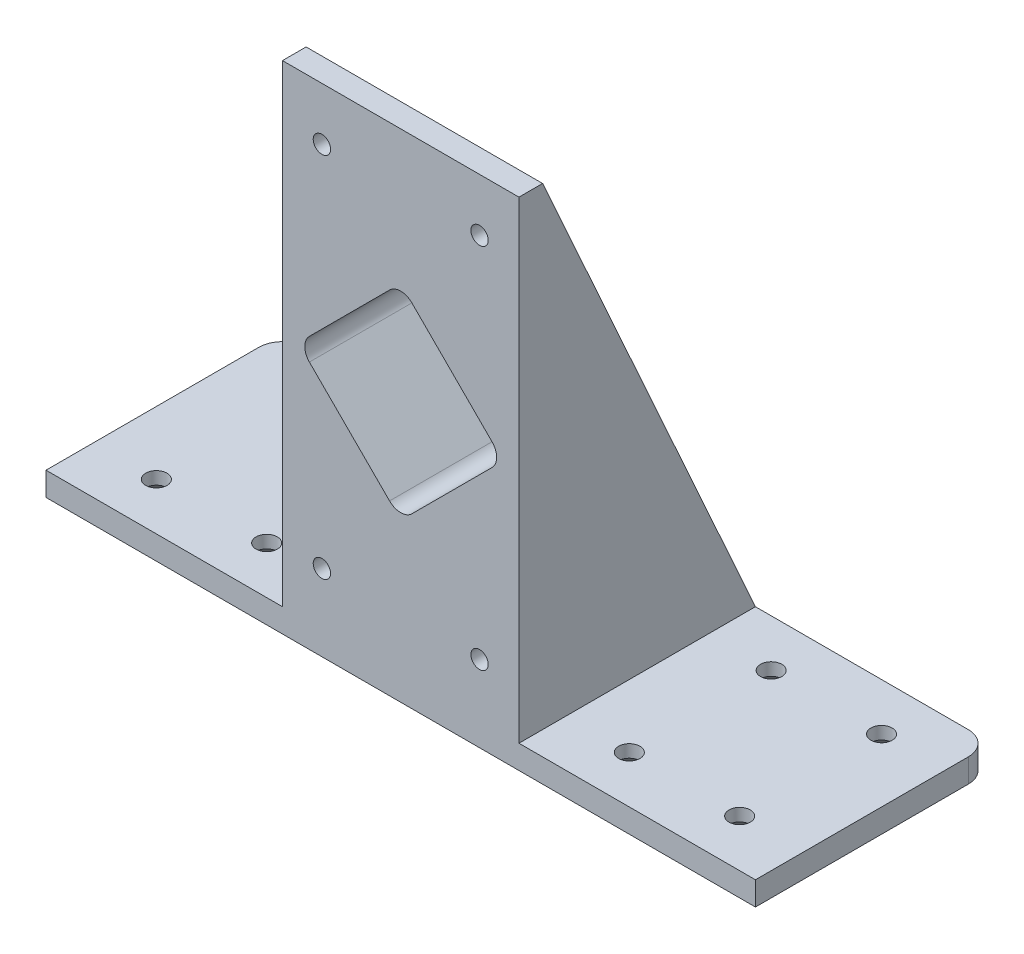
from build123d import *

# Parameters (mm, degrees)
SKETCH1_W                                            = 90
SKETCH1_H                                            = 30
BOSS_EXTRUDE1_DEPTH                                  = 3
SKETCH3_W                                            = 30
SKETCH3_H                                            = 3
BOSS_EXTRUDE2_DEPTH                                  = 60
RIB5_REACH                                           = 80.861
SKETCH8_WALL_W                                       = 225.516409736
SKETCH8_WALL_H                                       = 30
CUT_EXTRUDE2_REACH                                   = 85.03
SKETCH10_R                                           = 1.1
SKETCH12_R                                           = 2.5
CUT_EXTRUDE3_DEPTH                                   = 27
FILLET1_R                                            = 3
CUT_EXTRUDE4_REACH                                   = 85.03
FILLET2_R                                            = 2
CSK_FOR_M2_5_COUNTERSUNK_FLAT_HEAD_SCREW_D           = 2.7
CSK_FOR_M2_5_COUNTERSUNK_FLAT_HEAD_SCREW_CSINK_D     = 5.5
CSK_FOR_M2_5_COUNTERSUNK_FLAT_HEAD_SCREW_CSINK_ANGLE = 90
MIRROR1_AT_THE_SECOND_PLANE_COPY_1_D                 = 2.7
MIRROR1_AT_THE_SECOND_PLANE_COPY_1_CSINK_D           = 5.5
MIRROR1_AT_THE_SECOND_PLANE_COPY_1_CSINK_ANGLE       = 90


with BuildPart() as part:
    # Sketch1 → Boss-Extrude1 (new body)
    with BuildSketch(Plane(origin=(0, 0, 0), x_dir=(1, 0, 0), z_dir=(0, 1, 0))):
        Rectangle(SKETCH1_W, SKETCH1_H)
    extrude(amount=BOSS_EXTRUDE1_DEPTH)

    # Sketch3 → Boss-Extrude2 (add)
    with BuildSketch(Plane(origin=(0, 3, 0), x_dir=(1, 0, 0), z_dir=(0, 1, 0))):
        with Locations((0, -13.5)):
            Rectangle(SKETCH3_W, SKETCH3_H)
    extrude(amount=BOSS_EXTRUDE2_DEPTH)

    # Sketch8 wall → Rib5 (add, up to next)
    with BuildSketch(Plane(origin=(0, 33, -1.5), x_dir=(0, -0.911921505175, -0.410364677329), z_dir=(0, 0.410364677329, -0.911921505175)), mode=Mode.PRIVATE) as rib5_sk1:
        Rectangle(SKETCH8_WALL_W, SKETCH8_WALL_H)
    rib5_tool1 = extrude(rib5_sk1.sketch, amount=-RIB5_REACH, mode=Mode.PRIVATE) - part.part
    add(rib5_tool1.solids().sort_by_distance((0, 33, -1.5))[0])

    # Cut-Extrude2: up to this plane
    cut_extrude2_end = Plane(origin=(0, 63, 12), z_dir=(0, -0.410364677328798, 0.9119215051751063))
    # Sketch10 → Cut-Extrude2 (cut, up to the surface)
    with BuildSketch(Plane.XY.offset(15), mode=Mode.PRIVATE) as cut_extrude2_sk1:
        with Locations((-10, 56.3)):
            Circle(SKETCH10_R)
    cut_extrude2_tool1 = split(extrude(cut_extrude2_sk1.sketch, amount=-CUT_EXTRUDE2_REACH, mode=Mode.PRIVATE), bisect_by=cut_extrude2_end, keep=Keep.BOTH, mode=Mode.PRIVATE)
    add(cut_extrude2_tool1.solids().sort_by_distance((-10, 56.3, 15))[0], mode=Mode.SUBTRACT)
    # Sketch10 → Cut-Extrude2 (cut, up to the surface)
    with BuildSketch(Plane.XY.offset(15), mode=Mode.PRIVATE) as cut_extrude2_sk2:
        with Locations(Location((10, 56.3, 0), (0, 0, 90))):
            Circle(SKETCH10_R)
    cut_extrude2_tool2 = split(extrude(cut_extrude2_sk2.sketch, amount=-CUT_EXTRUDE2_REACH, mode=Mode.PRIVATE), bisect_by=cut_extrude2_end, keep=Keep.BOTH, mode=Mode.PRIVATE)
    add(cut_extrude2_tool2.solids().sort_by_distance((10, 56.3, 15))[0], mode=Mode.SUBTRACT)
    # Sketch10 → Cut-Extrude2 (cut, up to the surface)
    with BuildSketch(Plane.XY.offset(15), mode=Mode.PRIVATE) as cut_extrude2_sk3:
        with Locations((10, 9.7)):
            Circle(SKETCH10_R)
    cut_extrude2_tool3 = split(extrude(cut_extrude2_sk3.sketch, amount=-CUT_EXTRUDE2_REACH, mode=Mode.PRIVATE), bisect_by=cut_extrude2_end, keep=Keep.BOTH, mode=Mode.PRIVATE)
    add(cut_extrude2_tool3.solids().sort_by_distance((10, 9.7, 15))[0], mode=Mode.SUBTRACT)
    # Sketch10 → Cut-Extrude2 (cut, up to the surface)
    with BuildSketch(Plane.XY.offset(15), mode=Mode.PRIVATE) as cut_extrude2_sk4:
        with Locations(Location((-10, 9.7, 0), (0, 0, 90))):
            Circle(SKETCH10_R)
    cut_extrude2_tool4 = split(extrude(cut_extrude2_sk4.sketch, amount=-CUT_EXTRUDE2_REACH, mode=Mode.PRIVATE), bisect_by=cut_extrude2_end, keep=Keep.BOTH, mode=Mode.PRIVATE)
    add(cut_extrude2_tool4.solids().sort_by_distance((-10, 9.7, 15))[0], mode=Mode.SUBTRACT)

    # Sketch12 → Cut-Extrude3 (cut)
    with BuildSketch(Plane(origin=(0, 0, -15), x_dir=(-1, 0, 0), z_dir=(0, 0, -1))):
        with Locations((-10, 56.3)):
            Circle(SKETCH12_R)
        with Locations((10, 56.3)):
            Circle(SKETCH12_R)
        with Locations((10, 9.7)):
            Circle(SKETCH12_R)
        with Locations((-10, 9.7)):
            Circle(SKETCH12_R)
    extrude(amount=-CUT_EXTRUDE3_DEPTH, mode=Mode.SUBTRACT)

    # Fillet1
    fillet1_edges = [part.edges().sort_by_distance(p)[0] for p in [
        (-45, 1.5, -15),
        (45, 1.5, -15),
    ]]
    fillet(fillet1_edges, radius=FILLET1_R)

    # Cut-Extrude4: up to this plane
    cut_extrude4_end = Plane(origin=(0, 63, 12), z_dir=(0, -0.410364677328798, 0.9119215051751063))
    # Sketch13 → Cut-Extrude4 (cut, up to the surface)
    with BuildSketch(Plane.XY.offset(15), mode=Mode.PRIVATE) as cut_extrude4_sk1:
        Polygon((0, 20), (-13, 33), (0, 46), (13, 33), align=None)
    cut_extrude4_tool1 = split(extrude(cut_extrude4_sk1.sketch, amount=-CUT_EXTRUDE4_REACH, mode=Mode.PRIVATE), bisect_by=cut_extrude4_end, keep=Keep.BOTH, mode=Mode.PRIVATE)
    add(cut_extrude4_tool1.solids().sort_by_distance((0, 33, 15))[0], mode=Mode.SUBTRACT)

    # Fillet2
    fillet2_edges = [part.edges().sort_by_distance(p)[0] for p in [
        (13, 33, 6.75),
        (0, 20, 3.825),
        (-13, 33, 6.75),
        (0, 46, 9.675),
    ]]
    fillet(fillet2_edges, radius=FILLET2_R)

    # CSK for M2.5 Countersunk Flat Head Screw2 (through all)
    with Locations(Plane(origin=(-23, 0, 9), x_dir=(0, 0, -1), z_dir=(0, -1, 0))):
        with Locations((0, 0), (0, -14)):
            csk_for_m2_5_countersunk_flat_head_screw = CounterSinkHole(CSK_FOR_M2_5_COUNTERSUNK_FLAT_HEAD_SCREW_D / 2, CSK_FOR_M2_5_COUNTERSUNK_FLAT_HEAD_SCREW_CSINK_D / 2, counter_sink_angle=CSK_FOR_M2_5_COUNTERSUNK_FLAT_HEAD_SCREW_CSINK_ANGLE)

    # Mirror1: CSK for M2.5 Countersunk Flat Head Screw2 across plane
    add(csk_for_m2_5_countersunk_flat_head_screw.mirror(Plane(origin=(0, 0, 0), x_dir=(0, 0, 1), z_dir=(1, 0, 0))), mode=Mode.SUBTRACT)

    # Mirror1 at the second plane: CSK for M2.5 Countersunk Flat Head Screw2 across plane
    add(csk_for_m2_5_countersunk_flat_head_screw.mirror(Plane.XY), mode=Mode.SUBTRACT)

    # Mirror1 at the second plane copy 1 (through all)
    with Locations(Plane(origin=(23, 0, -9), x_dir=(0, 0, 1), z_dir=(0, -1, 0))):
        with Locations((0, 0), (0, -14)):
            CounterSinkHole(MIRROR1_AT_THE_SECOND_PLANE_COPY_1_D / 2, MIRROR1_AT_THE_SECOND_PLANE_COPY_1_CSINK_D / 2, counter_sink_angle=MIRROR1_AT_THE_SECOND_PLANE_COPY_1_CSINK_ANGLE)


solid = part.part
